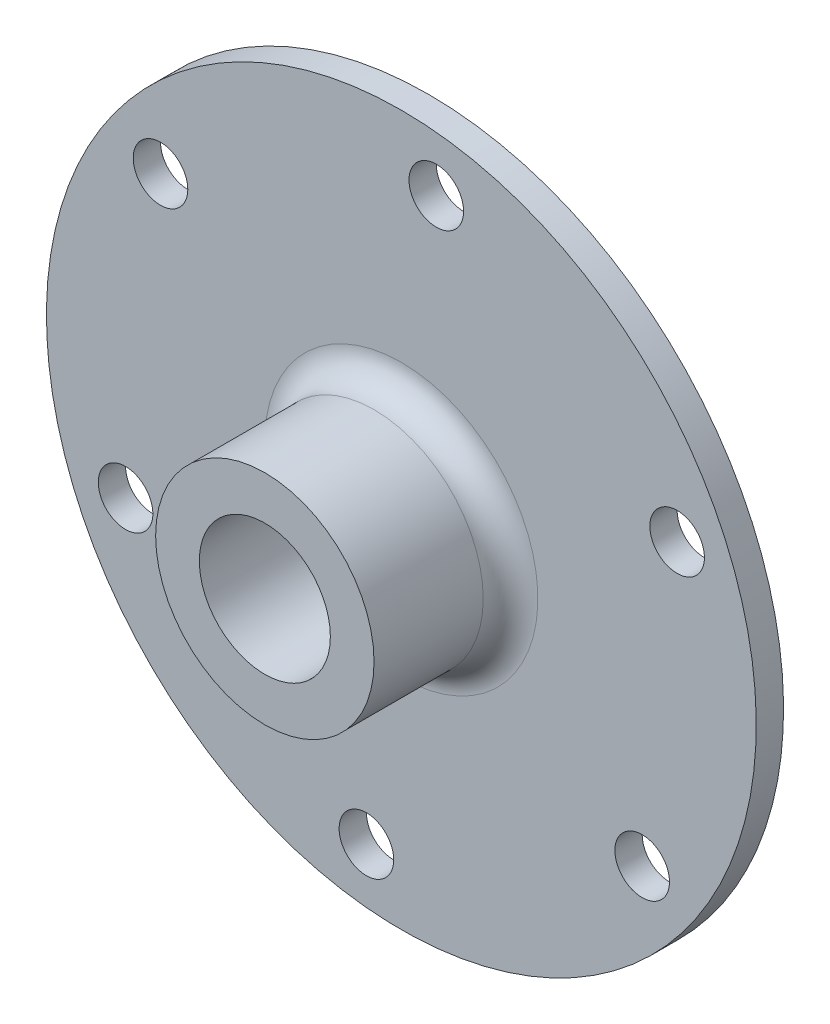
from build123d import *

# Parameters (mm, degrees)
SKETCH3_R          = 7.62
SKETCH3_R_2        = 3.175
CUT_EXTRUDE1_DEPTH = 62.401577748
CIRPATTERN1_COUNT  = 6
FILLET1_R          = 3.175


with BuildPart() as part:
    # Sketch2 → Revolve1 (revolve)
    with BuildSketch(Plane(origin=(0, 0, 0), x_dir=(0, 0, -1), z_dir=(1, 0, 0))):
        Polygon((0, 0), (0, 41.275), (-3.175, 41.275), (-3.175, 12.7), (-19.05, 12.7), (-19.05, 0), align=None)
    revolve(axis=Axis((0, 0, 0), (0, 0, 1)))

    # Sketch3 → Cut-Extrude1 (cut, through all)
    with BuildSketch(Plane.XY.offset(19.05)):
        Circle(SKETCH3_R)
        with Locations((-28.008609796, 20.863206903)):
            Circle(SKETCH3_R_2)
    cut_extrude1 = extrude(amount=-CUT_EXTRUDE1_DEPTH, mode=Mode.SUBTRACT)

    # CirPattern1: Cut-Extrude1 ×6 about axis
    cirpattern1_axis = Axis((0, 0, 0), (0, 0, 1))
    for i in range(1, CIRPATTERN1_COUNT):
        add(cut_extrude1.rotate(cirpattern1_axis, i * 360 / CIRPATTERN1_COUNT), mode=Mode.SUBTRACT)

    # Fillet1
    fillet1_edges = [part.edges().sort_by_distance(p)[0] for p in [
        (0, -12.7, 3.175),
    ]]
    fillet(fillet1_edges, radius=FILLET1_R)


solid = part.part
